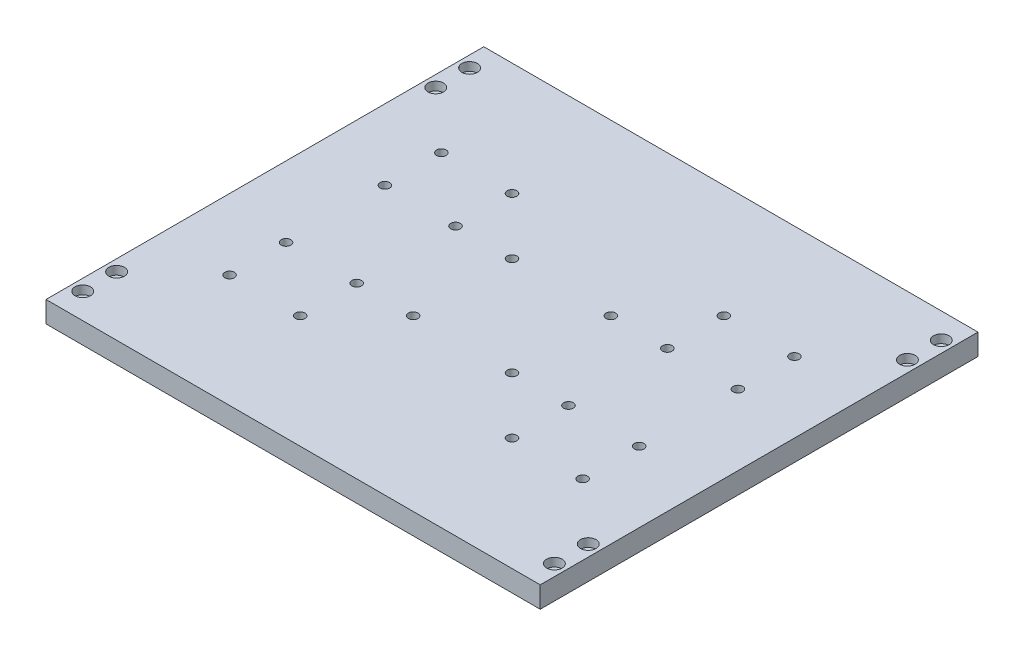
from build123d import *

# Parameters (mm, degrees)
SKETCH_2_W             = 350
SKETCH_2_H             = 310
EXTRUDE_1_DEPTH        = 15
SKETCH_3_R             = 3
CUT_EXTRUDE_1_DEPTH    = 468.787344848
SKETCH_4_R             = 5.5
CUT_EXTRUDE_2_DEPTH    = 6
HOLE_WIZARD_M8_1_D     = 6.8
HOLE_WIZARD_M8_1_DEPTH = 19.75
HOLE_WIZARD_M8_1_TIP   = 2.042926105


with BuildPart() as part:
    # 草图2 → 凸台-拉伸1 (new body)
    with BuildSketch(Plane(origin=(0, 0, 0), x_dir=(1, 0, 0), z_dir=(0, 1, 0))):
        with Locations((175, 155)):
            Rectangle(SKETCH_2_W, SKETCH_2_H)
    extrude(amount=EXTRUDE_1_DEPTH)

    # 草图3 → 切除-拉伸1 (cut, through all)
    with BuildSketch(Plane(origin=(0, 15, 0), x_dir=(1, 0, 0), z_dir=(0, 1, 0))):
        with Locations(Location((342, 292, 0), (0, 0, 270))):
            Circle(SKETCH_3_R)
        with Locations(Location((342, 268, 0), (0, 0, 270))):
            Circle(SKETCH_3_R)
        with Locations(Location((342, 42, 0), (0, 0, 90))):
            Circle(SKETCH_3_R)
        with Locations(Location((342, 18, 0), (0, 0, 90))):
            Circle(SKETCH_3_R)
        with Locations(Location((8, 18, 0), (0, 0, 270))):
            Circle(SKETCH_3_R)
        with Locations(Location((8, 42, 0), (0, 0, 270))):
            Circle(SKETCH_3_R)
        with Locations(Location((8, 268, 0), (0, 0, 90))):
            Circle(SKETCH_3_R)
        with Locations(Location((8, 292, 0), (0, 0, 90))):
            Circle(SKETCH_3_R)
    extrude(amount=-CUT_EXTRUDE_1_DEPTH, mode=Mode.SUBTRACT)

    # 草图4 → 切除-拉伸2 (cut)
    with BuildSketch(Plane(origin=(0, 15, 0), x_dir=(1, 0, 0), z_dir=(0, 1, 0))):
        with Locations(Location((342, 292, 0), (0, 0, 270))):
            Circle(SKETCH_4_R)
        with Locations(Location((342, 268, 0), (0, 0, 270))):
            Circle(SKETCH_4_R)
        with Locations(Location((342, 42, 0), (0, 0, 90))):
            Circle(SKETCH_4_R)
        with Locations(Location((342, 18, 0), (0, 0, 90))):
            Circle(SKETCH_4_R)
        with Locations(Location((8, 18, 0), (0, 0, 270))):
            Circle(SKETCH_4_R)
        with Locations(Location((8, 42, 0), (0, 0, 270))):
            Circle(SKETCH_4_R)
        with Locations(Location((8, 268, 0), (0, 0, 90))):
            Circle(SKETCH_4_R)
        with Locations(Location((8, 292, 0), (0, 0, 90))):
            Circle(SKETCH_4_R)
    extrude(amount=-CUT_EXTRUDE_2_DEPTH, mode=Mode.SUBTRACT)

    # M8 螺纹孔1
    with Locations(Plane(origin=(50, 15, -230), x_dir=(0, 0, 1), z_dir=(0, 1, 0))):
        with Locations((0, 0), (0, 50), (40, 0), (40, 50), (40, 90), (40, 160), (0, 200), (0, 250), (40, 250), (40, 200), (110, 0), (110, 50), (110, 90), (110, 160), (110, 200), (110, 250), (150, 250), (150, 200), (150, 50), (150, 0)):
            Hole(HOLE_WIZARD_M8_1_D / 2, depth=HOLE_WIZARD_M8_1_DEPTH)
            with Locations((0, 0, -(HOLE_WIZARD_M8_1_DEPTH + HOLE_WIZARD_M8_1_TIP / 2))):  # 118° drill point
                Cone(0, HOLE_WIZARD_M8_1_D / 2, HOLE_WIZARD_M8_1_TIP, mode=Mode.SUBTRACT)


solid = part.part
